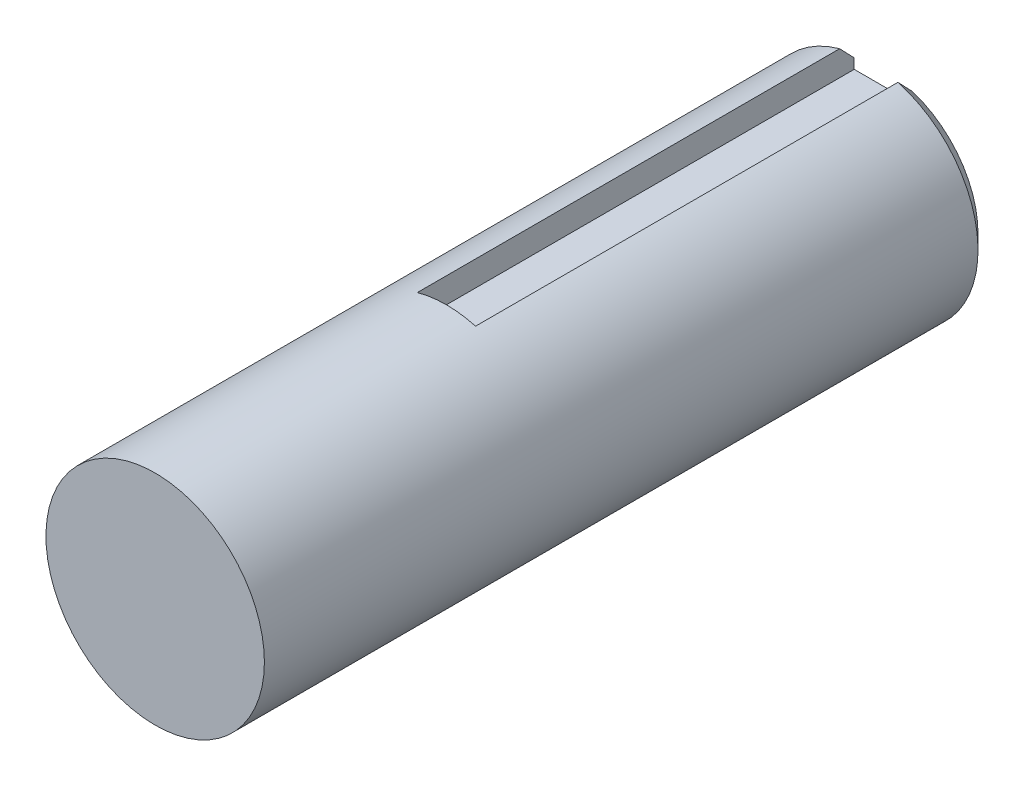
from build123d import *

# Parameters (mm, degrees)
SKETCH1_R           = 15
BOSS_EXTRUDE1_DEPTH = 100
CHAMFER1_SIZE       = 2
SKETCH3_W           = 8
SKETCH3_H           = 60
CUT_EXTRUDE1_DEPTH  = 4
FILLET1_R           = 3


with BuildPart() as part:
    # Sketch1 → Boss-Extrude1 (new body)
    with BuildSketch(Plane.XY):
        Circle(SKETCH1_R)
    extrude(amount=BOSS_EXTRUDE1_DEPTH)

    # Chamfer1
    chamfer1_edges = [part.edges().sort_by_distance(p)[0] for p in [
        (-15, 0, 0),
    ]]
    chamfer(chamfer1_edges, length=CHAMFER1_SIZE)

    # Sketch3 → Cut-Extrude1 (cut)
    with BuildSketch(Plane(origin=(0, 15, 100), x_dir=(1, 0, 0), z_dir=(0, 1, 0))):
        with Locations((0, 70)):
            Rectangle(SKETCH3_W, SKETCH3_H)
    extrude(amount=-CUT_EXTRUDE1_DEPTH, mode=Mode.SUBTRACT)

    # Fillet1
    fillet1_edges = [part.edges().sort_by_distance(p)[0] for p in [
        (0, 11, 60),
    ]]
    fillet(fillet1_edges, radius=FILLET1_R)


solid = part.part
